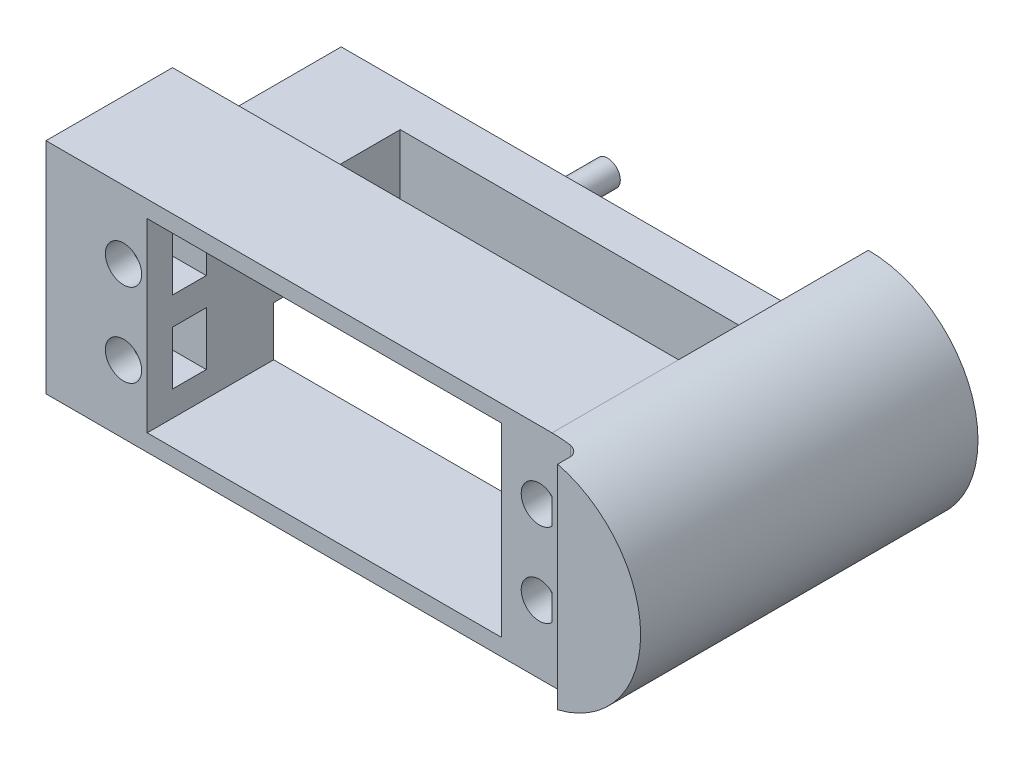
from build123d import *

# Parameters (mm, degrees)
BOSS_EXTRU_1_DEPTH      = 15
ESQUISSE2_W             = 42
ESQUISSE2_H             = 22
ENL_V_MAT_EXTRU_1_DEPTH = 48.36032094485848
ESQUISSE4_R             = 2.1499999999999972
ESQUISSE4_R_2           = 2.1499999999999977
ESQUISSE4_R_3           = 2.1500000000000012
ENL_V_MAT_EXTRU_2_DEPTH = 3
ESQUISSE5_W             = 4
ESQUISSE5_H             = 6.35
ENL_V_MAT_EXTRU_3_DEPTH = 6
ENL_V_MAT_EXTRU_4_DEPTH = 8
BOSS_EXTRU_6_START      = 20
ESQUISSE10_W            = 12.000000000000007
ESQUISSE10_H            = 10.265502917405067
BOSS_EXTRU_6_DEPTH      = 20
ESQUISSE11_W            = 42
ESQUISSE11_H            = 10.265502917405069
BOSS_EXTRU_7_DEPTH      = 5
BOSS_EXTRU_8_DEPTH      = 2.5
BOSS_EXTRU_8_DEPTH_BACK = 35
ESQUISSE13_R            = 1.5500000000000012
ENL_V_MAT_EXTRU_5_DEPTH = 59.51709152034131
BOSS_EXTRU_9_DEPTH      = 2.5
CONG_1_R                = 1
ESQUISSE15_R            = 1.4999999999999987
BOSS_EXTRU_10_DEPTH     = 8
CONG_2_R                = 3.5


with BuildPart() as part:
    # Esquisse1 → Boss.-Extru.1 (new body)
    with BuildSketch(Plane.XY):
        with BuildLine():
            Line((30, -12.999999999999996), (-30, -13.000000000000004))
            Line((-30, -13.000000000000004), (-30, 12.999999999999996))
            Line((-30, 12.999999999999996), (30, 13.000000000000004))
            ThreePointArc((30, 13.000000000000004), (43.00000000000001, 3.47e-15), (30, -12.999999999999996))
        make_face()
    extrude(amount=BOSS_EXTRU_1_DEPTH)

    # Esquisse2 → Enlèv. mat.-Extru.1 (cut, through all)
    with BuildSketch(Plane.XY.offset(15)):
        with Locations((3.0000000000000053, 0)):
            Rectangle(ESQUISSE2_W, ESQUISSE2_H)
    extrude(amount=-ENL_V_MAT_EXTRU_1_DEPTH, mode=Mode.SUBTRACT)

    # Esquisse4 → Enlèv. mat.-Extru.2 (cut)
    with BuildSketch(Plane.XY.offset(15)):
        with Locations((-20.809999999999974, 4.934999999999995)):
            Circle(ESQUISSE4_R)
        with Locations((-20.809999999999974, -4.935000000000005)):
            Circle(ESQUISSE4_R_2)
        with Locations((28.490000000000016, 4.934999999999976)):
            Circle(ESQUISSE4_R_3)
        with Locations((28.490000000000016, -4.93499999999999)):
            Circle(ESQUISSE4_R_3)
    extrude(amount=-ENL_V_MAT_EXTRU_2_DEPTH, mode=Mode.SUBTRACT)

    # Esquisse5 → Enlèv. mat.-Extru.3 (cut)
    with BuildSketch(Plane(origin=(-17.999999999999996, 0, 0), x_dir=(0, 0, -1), z_dir=(1, 0, 0))):
        with Locations((-10, -4.825)):
            Rectangle(ESQUISSE5_W, ESQUISSE5_H)
        with Locations((-10, 4.825)):
            Rectangle(ESQUISSE5_W, ESQUISSE5_H)
    extrude(amount=-ENL_V_MAT_EXTRU_3_DEPTH, mode=Mode.SUBTRACT)

    # Esquisse6 → Enlèv. mat.-Extru.4 (cut)
    with BuildSketch(Plane.ZY.offset(-24.000000000000007)):
        Polygon((12, 8), (8, 8), (8, 1.65), (12, 1.6500000000000004), align=None)
        Polygon((12, -1.6500000000000004), (8, -1.65), (8, -8), (12, -8), align=None)
    extrude(amount=-ENL_V_MAT_EXTRU_4_DEPTH, mode=Mode.SUBTRACT)

    # Esquisse10 → Boss.-Extru.6 (add)
    with BuildSketch(Plane(origin=(0, 0, 0), x_dir=(-1, 0, 0), z_dir=(0, 0, -1)).offset(BOSS_EXTRU_6_START)):
        with Locations((24, 0)):
            Rectangle(ESQUISSE10_W, ESQUISSE10_H)
        with BuildLine():
            Line((-24.000000000000007, 5.1327514587025345), (-41.94382109976481, 5.132751458702534))
            ThreePointArc((-41.94382109976481, 5.132751458702534), (-43, -7.1e-16), (-41.94382109976481, -5.132751458702534))
            Line((-41.94382109976481, -5.132751458702534), (-24.000000000000007, -5.132751458702534))
            Line((-24.000000000000007, -5.132751458702534), (-24.000000000000007, 5.1327514587025345))
        make_face()
    extrude(amount=-BOSS_EXTRU_6_DEPTH)

    # Esquisse11 → Boss.-Extru.7 (add)
    with BuildSketch(Plane(origin=(0, 0, -20), x_dir=(-1, 0, 0), z_dir=(0, 0, -1))):
        with Locations((-3.0000000000000053, 4.4e-16)):
            Rectangle(ESQUISSE11_W, ESQUISSE11_H)
    extrude(amount=-BOSS_EXTRU_7_DEPTH)

    # Esquisse12 → Boss.-Extru.8 (add, two sides: drawn at the far end of the back side and taken through both)
    with BuildSketch(Plane(origin=(0, 0, -20), x_dir=(-1, 0, 0), z_dir=(0, 0, -1)).offset(-BOSS_EXTRU_8_DEPTH_BACK)):
        with BuildLine():
            Line((-29.999999999999993, -12.999999999999996), (-30, 13.000000000000004))
            ThreePointArc((-30, 13.000000000000004), (-37.151021991186546, 10.8564674034221), (-41.94382109976481, 5.132751458702534))
            ThreePointArc((-41.94382109976481, 5.132751458702534), (-43, 5.06e-15), (-41.94382109976481, -5.132751458702532))
            ThreePointArc((-41.94382109976481, -5.132751458702532), (-37.15102199118654, -10.856467403422094), (-29.999999999999993, -12.999999999999996))
        make_face()
    extrude(amount=BOSS_EXTRU_8_DEPTH + BOSS_EXTRU_8_DEPTH_BACK)

    # Esquisse13 → Enlèv. mat.-Extru.5 (cut, through all)
    with BuildSketch(Plane.XY.offset(15)):
        with Locations((36.030874159306855, 4.6664949567902845)):
            Circle(ESQUISSE13_R)
        with Locations((36.030874159306855, -5.3335050432097155)):
            Circle(ESQUISSE13_R)
    extrude(amount=-ENL_V_MAT_EXTRU_5_DEPTH, mode=Mode.SUBTRACT)

    # Esquisse14 → Boss.-Extru.9 (add)
    with BuildSketch(Plane.XY.offset(15)):
        with BuildLine():
            Line((33.160130873307615, 12.610058400482057), (33.160130873307615, -12.610058400482053))
            ThreePointArc((33.160130873307615, -12.610058400482053), (43.00000000000001, 3.47e-15), (33.160130873307615, 12.610058400482057))
        make_face()
    extrude(amount=BOSS_EXTRU_9_DEPTH)

    # Congé1
    cong_1_edges = [part.edges().sort_by_distance(p)[0] for p in [
        (33.160130873307615, 1.78e-15, 15),
    ]]
    fillet(cong_1_edges, radius=CONG_1_R)

    # Esquisse15 → Boss.-Extru.10 (add)
    with BuildSketch(Plane(origin=(0, 0, -20), x_dir=(-1, 0, 0), z_dir=(0, 0, -1))):
        with Locations((6.410000000000011, 6.006e-14)):
            Circle(ESQUISSE15_R)
    extrude(amount=BOSS_EXTRU_10_DEPTH)

    # Congé2
    cong_2_edges = [part.edges().sort_by_distance(p)[0] for p in [
        (-4.910000000000013, 6.024e-14, -20),
    ]]
    fillet(cong_2_edges, radius=CONG_2_R)


solid = part.part
